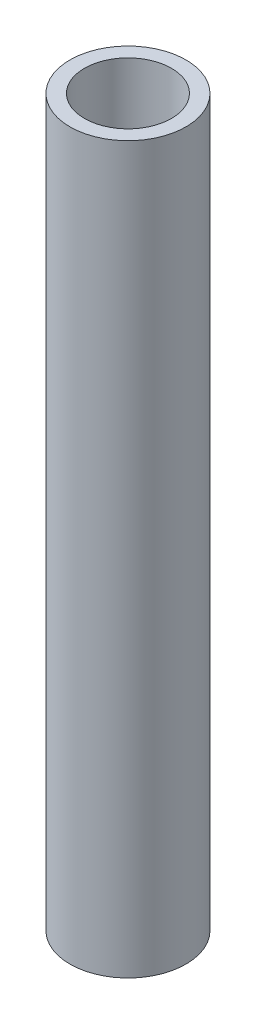
from build123d import *

# Parameters (mm, degrees)
BOSS_EXTRU_1_DEPTH      = 9
BOSS_EXTRU_1_DEPTH_BACK = 41
ESQUISSE1_R             = 4
ESQUISSE1_R_2           = 3


with BuildPart() as part:
    # Esquisse1 → Boss.-Extru.1 (new, two sides: drawn at the far end of the back side and taken through both)
    with BuildSketch(Plane(origin=(0, 0, 0), x_dir=(1, 0, 0), z_dir=(0, 1, 0)).offset(-BOSS_EXTRU_1_DEPTH_BACK)):
        with Locations(Location((0, 0, 0), (0, 0, 270))):
            Circle(ESQUISSE1_R)
        with Locations(Location((0, 0, 0), (0, 0, 270))):
            Circle(ESQUISSE1_R_2, mode=Mode.SUBTRACT)
    extrude(amount=BOSS_EXTRU_1_DEPTH + BOSS_EXTRU_1_DEPTH_BACK)


solid = part.part
